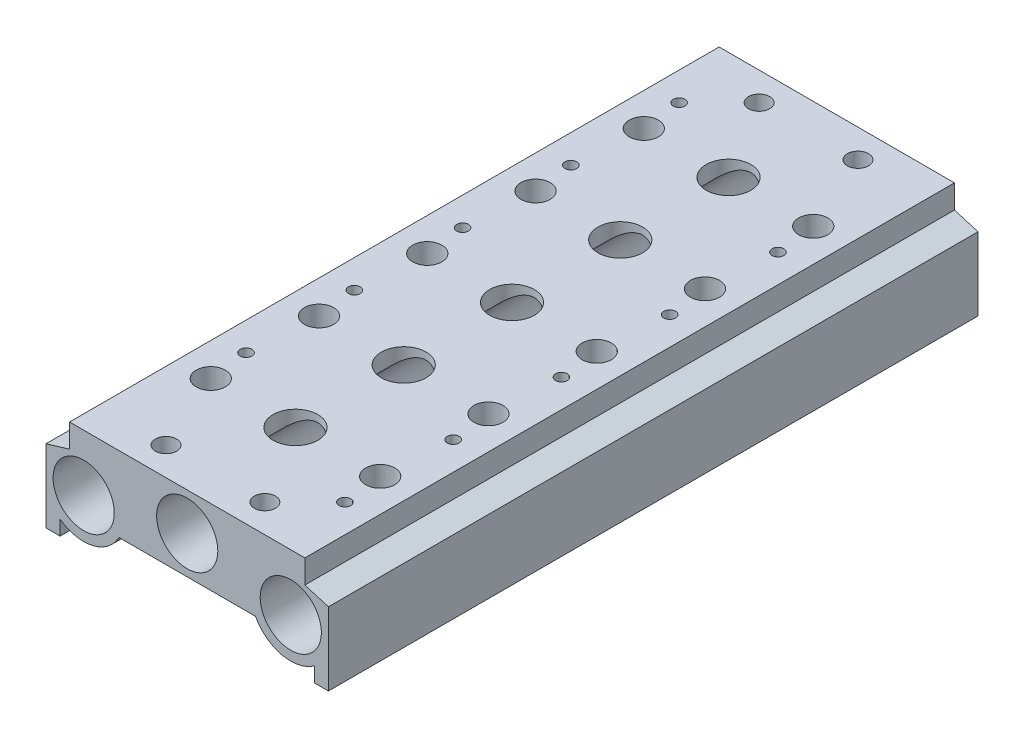
from build123d import *

# Parameters (mm, degrees)
SKETCH_1_R                  = 6.5
EXTRUDE_1_DEPTH             = 69
CUT_EXTRUDE_1_REACH         = 80.39
SKETCH_2_R                  = 2.25
SKETCH_3_R                  = 4.75
SKETCH_3_R_2                = 3.1
CUT_EXTRUDE_2_DEPTH         = 12
HOLE_WIZARD_M3_1_AT_2_COUNT = 2
HOLE_WIZARD_M3_1_AT_2_PITCH = 41.629316593
PATTERN_LINEAR_1_COUNT      = 5
PATTERN_LINEAR_1_PITCH      = 23
PATTERN_LINEAR_2_COUNT      = 5
PATTERN_LINEAR_2_PITCH      = 23


with BuildPart() as part:
    # 草图1 → 凸台-拉伸1 (new, symmetric)
    with BuildSketch(Plane.XY):
        with BuildLine():
            Line((-14.5, -5), (14.5, -5))
            ThreePointArc((14.5, -5), (20.09545992, -9.283883575), (27, -7.873863542))
            Line((27, -7.873863542), (27, -11))
            Line((27, -11), (30, -11))
            Line((30, -11), (30, 4.5))
            Line((30, 4.5), (25, 6))
            Line((25, 6), (25, 11))
            Line((25, 11), (-25, 11))
            Line((-25, 11), (-25, 6))
            Line((-25, 6), (-30, 4.5))
            Line((-30, 4.5), (-30, -11))
            Line((-30, -11), (-27, -11))
            Line((-27, -11), (-27, -7.873863542))
            ThreePointArc((-27, -7.873863542), (-20.09545992, -9.283883575), (-14.5, -5))
        make_face()
        with Locations((0, 3)):
            Circle(SKETCH_1_R, mode=Mode.SUBTRACT)
        with Locations((-22, -1)):
            Circle(SKETCH_1_R, mode=Mode.SUBTRACT)
        with Locations(Location((22, -1, 0), (0, 0, 180))):
            Circle(SKETCH_1_R, mode=Mode.SUBTRACT)
    extrude(amount=EXTRUDE_1_DEPTH, both=True)

    # 草图2 → 切除-拉伸1 (cut, up to next)
    with BuildSketch(Plane(origin=(0, 11, 0), x_dir=(1, 0, 0), z_dir=(0, 1, 0)), mode=Mode.PRIVATE) as cut_extrude_1_sk1:
        with Locations(Location((10.5, 63, 0), (0, 0, 270))):
            Circle(SKETCH_2_R)
    cut_extrude_1_tool1 = extrude(cut_extrude_1_sk1.sketch, amount=-CUT_EXTRUDE_1_REACH, mode=Mode.PRIVATE) & part.part
    # 草图2 → 切除-拉伸1 (cut, up to next)
    with BuildSketch(Plane(origin=(0, 11, 0), x_dir=(1, 0, 0), z_dir=(0, 1, 0)), mode=Mode.PRIVATE) as cut_extrude_1_sk2:
        with Locations(Location((-10.5, 63, 0), (0, 0, 270))):
            Circle(SKETCH_2_R)
    cut_extrude_1_tool2 = extrude(cut_extrude_1_sk2.sketch, amount=-CUT_EXTRUDE_1_REACH, mode=Mode.PRIVATE) & part.part
    cut_extrude_1_1 = cut_extrude_1_tool1.solids().sort_by_distance((10.5, 11, -63))[0]
    add(cut_extrude_1_1, mode=Mode.SUBTRACT)
    cut_extrude_1_2 = cut_extrude_1_tool2.solids().sort_by_distance((-10.5, 11, -63))[0]
    add(cut_extrude_1_2, mode=Mode.SUBTRACT)
    cut_extrude_1 = cut_extrude_1_1 + cut_extrude_1_2  # 切除-拉伸1 as one shape, for the pattern or mirror that repeats it

    # 镜向1: 切除-拉伸1 across plane
    add(cut_extrude_1.mirror(Plane.XY), mode=Mode.SUBTRACT)

    # 草图3 → 切除-拉伸2 (cut)
    with BuildSketch(Plane(origin=(0, 11, 0), x_dir=(1, 0, 0), z_dir=(0, 1, 0))):
        with Locations(Location((0, 46, 0), (0, 0, 270))):
            Circle(SKETCH_3_R)
        with Locations(Location((-18, 46, 0), (0, 0, 270))):
            Circle(SKETCH_3_R_2)
        with Locations(Location((18, 46, 0), (0, 0, 270))):
            Circle(SKETCH_3_R_2)
    cut_extrude_2 = extrude(amount=-CUT_EXTRUDE_2_DEPTH, mode=Mode.SUBTRACT)

    # 草图4 → M3 螺纹孔1 (revolve, cut)
    with BuildSketch(Plane(origin=(-19, 11, -54.5), x_dir=(0, 0, 1), z_dir=(1, 0, 0))):
        Polygon((0, 0), (0, 8.251075774), (1.25, 7.5), (1.25, 0), align=None)
    hole_wizard_m3_1 = revolve(axis=Axis((-19, 17.35, -54.5), (0, -1, 0)), mode=Mode.SUBTRACT)

    # M3 螺纹孔1 at 2: M3 螺纹孔1 ×2
    with Locations(*[Vector(0.9128182518949205, 0, 0.4083660600582539) * (i * HOLE_WIZARD_M3_1_AT_2_PITCH) for i in range(1, HOLE_WIZARD_M3_1_AT_2_COUNT)]):
        add(hole_wizard_m3_1, mode=Mode.SUBTRACT)

    # 阵列(线性)1: 切除-拉伸2 ×5
    with Locations(*[(0, 0, i * PATTERN_LINEAR_1_PITCH) for i in range(1, PATTERN_LINEAR_1_COUNT)]):
        add(cut_extrude_2, mode=Mode.SUBTRACT)

    # 阵列(线性)2: M3 螺纹孔1 ×5
    with Locations(*[(0, 0, i * PATTERN_LINEAR_2_PITCH) for i in range(1, PATTERN_LINEAR_2_COUNT)]):
        add(hole_wizard_m3_1, mode=Mode.SUBTRACT)

    # 阵列(线性)2 copy 1 sketch → 阵列(线性)2 copy 1 (revolve, cut)
    with BuildSketch(Plane(origin=(19, 11, -14.5), x_dir=(0, 0, 1), z_dir=(1, 0, 0))):
        Polygon((0, 0), (0, 8.251075774), (1.25, 7.5), (1.25, 0), align=None)
    revolve(axis=Axis((19, 17.35, -14.5), (0, -1, 0)), mode=Mode.SUBTRACT)

    # 阵列(线性)2 copy 2 sketch → 阵列(线性)2 copy 2 (revolve, cut)
    with BuildSketch(Plane(origin=(19, 11, 8.5), x_dir=(0, 0, 1), z_dir=(1, 0, 0))):
        Polygon((0, 0), (0, 8.251075774), (1.25, 7.5), (1.25, 0), align=None)
    revolve(axis=Axis((19, 17.35, 8.5), (0, -1, 0)), mode=Mode.SUBTRACT)

    # 阵列(线性)2 copy 3 sketch → 阵列(线性)2 copy 3 (revolve, cut)
    with BuildSketch(Plane(origin=(19, 11, 31.5), x_dir=(0, 0, 1), z_dir=(1, 0, 0))):
        Polygon((0, 0), (0, 8.251075774), (1.25, 7.5), (1.25, 0), align=None)
    revolve(axis=Axis((19, 17.35, 31.5), (0, -1, 0)), mode=Mode.SUBTRACT)

    # 阵列(线性)2 copy 4 sketch → 阵列(线性)2 copy 4 (revolve, cut)
    with BuildSketch(Plane(origin=(19, 11, 54.5), x_dir=(0, 0, 1), z_dir=(1, 0, 0))):
        Polygon((0, 0), (0, 8.251075774), (1.25, 7.5), (1.25, 0), align=None)
    revolve(axis=Axis((19, 17.35, 54.5), (0, -1, 0)), mode=Mode.SUBTRACT)


solid = part.part
